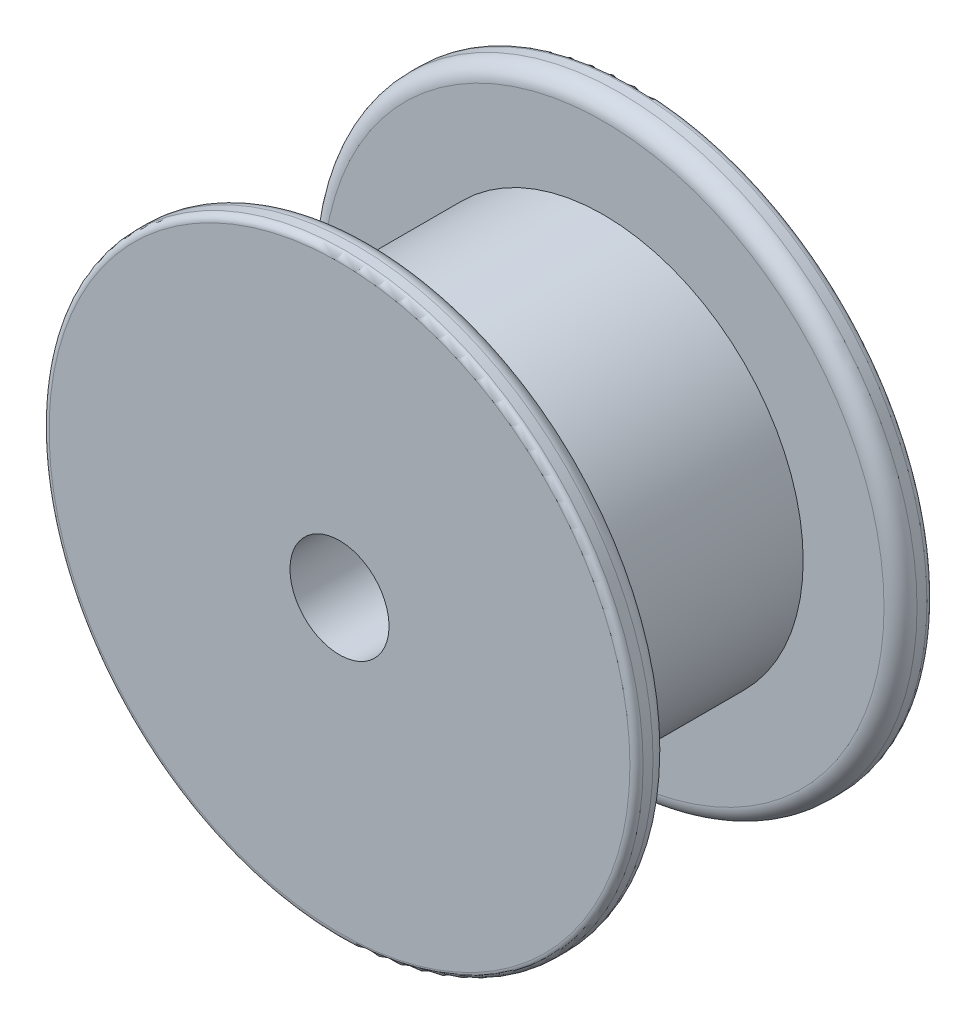
from build123d import *

# Parameters (mm, degrees)
SKETCH1_R           = 6.05
BOSS_EXTRUDE1_DEPTH = 7
SKETCH4_R           = 9
BOSS_EXTRUDE2_DEPTH = 1
BOSS_EXTRUDE3_START = 1
SKETCH6_R           = 9
BOSS_EXTRUDE3_DEPTH = 1
FILLET1_R           = 0.5
FILLET2_R           = 0.5
FILLET3_R           = 0.2
FILLET4_R           = 0.2
SKETCH11_R          = 1.5
CUT_EXTRUDE1_DEPTH  = 81.5497711


with BuildPart() as part:
    # Sketch1 → Boss-Extrude1 (new body)
    with BuildSketch(Plane.XY):
        with Locations((69.685635463, 5.691370847)):
            Circle(SKETCH1_R)
    extrude(amount=BOSS_EXTRUDE1_DEPTH)

    # Sketch4 → Boss-Extrude2 (add)
    with BuildSketch(Plane.XY.offset(7)):
        with Locations((69.685635463, 5.691370847)):
            Circle(SKETCH4_R)
    extrude(amount=BOSS_EXTRUDE2_DEPTH)

    # Sketch6 → Boss-Extrude3 (add)
    with BuildSketch(Plane(origin=(0, 0, 0), x_dir=(-1, 0, 0), z_dir=(0, 0, -1)).offset(BOSS_EXTRUDE3_START)):
        with Locations(Location((-69.685635463, 5.691370847, 0), (0, 0, 180))):
            Circle(SKETCH6_R)
    extrude(amount=-BOSS_EXTRUDE3_DEPTH)

    # Fillet1
    fillet1_edges = [part.edges().sort_by_distance(p)[0] for p in [
        (60.685635463, 5.691370847, 0),
    ]]
    fillet(fillet1_edges, radius=FILLET1_R)

    # Fillet2
    fillet2_edges = [part.edges().sort_by_distance(p)[0] for p in [
        (60.685635463, 5.691370847, 7),
    ]]
    fillet(fillet2_edges, radius=FILLET2_R)

    # Fillet3
    fillet3_edges = [part.edges().sort_by_distance(p)[0] for p in [
        (60.685635463, 5.691370847, 8),
    ]]
    fillet(fillet3_edges, radius=FILLET3_R)

    # Fillet4
    fillet4_edges = [part.edges().sort_by_distance(p)[0] for p in [
        (60.685635463, 5.691370847, -1),
    ]]
    fillet(fillet4_edges, radius=FILLET4_R)

    # Sketch11 → Cut-Extrude1 (cut, through all)
    with BuildSketch(Plane(origin=(0, 0, -1), x_dir=(-1, 0, 0), z_dir=(0, 0, -1))):
        with Locations((-69.685635463, 5.691370847)):
            Circle(SKETCH11_R)
    extrude(amount=-CUT_EXTRUDE1_DEPTH, mode=Mode.SUBTRACT)


solid = part.part
